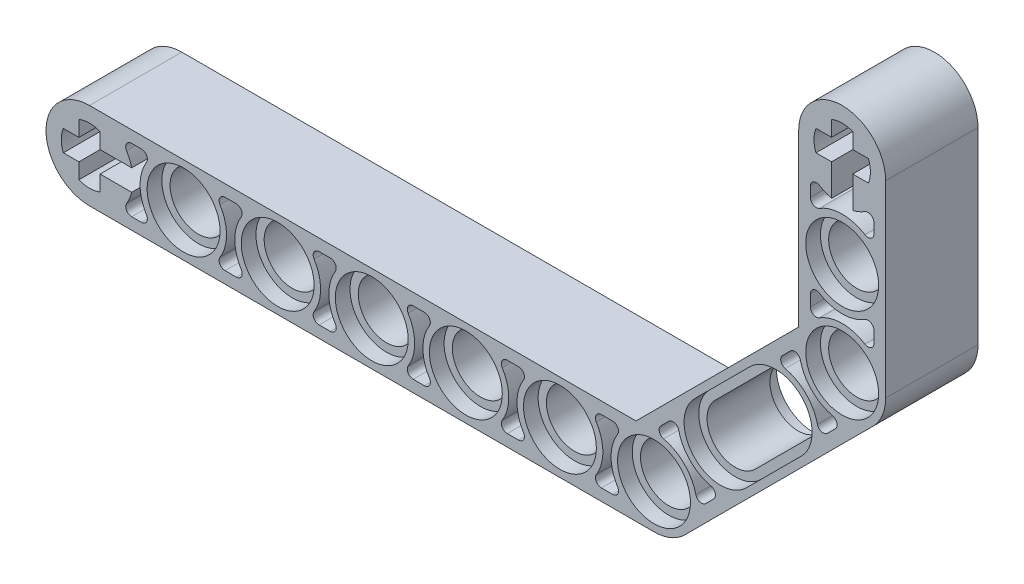
from build123d import *

# Parameters (mm, degrees)
SKETCH1_R            = 2.4
BEAM_DEPTH           = 3.925
AXLE_CUT_DEPTH       = 77.636711992
AXLE_CUT_DEPTH_BACK  = 77.636711992
SKETCH3_R            = 3.1
HOLE_SURROUND_DEPTH  = 1.25
CAVITY_CUT_DEPTH     = 3
FILLET2_R            = 0.5
FILLET2_OF_MIRROR2_R = 0.5
FILLET3_R            = 0.5


with BuildPart() as part:
    # Sketch1 → Beam (new, symmetric)
    with BuildSketch(Plane.XY):
        with BuildLine():
            Line((46.467409819, 3.7), (0, 3.7))
            ThreePointArc((0, 3.7), (-3.7, 0), (0, -3.7))
            Line((0, -3.7), (48, -3.7))
            ThreePointArc((48, -3.7), (49.4159287, -3.41835427), (50.61629509, -2.61629509))
            Line((50.61629509, -2.61629509), (66.61629509, 13.38370491))
            ThreePointArc((66.61629509, 13.38370491), (67.41835427, 14.5840713), (67.7, 16))
            Line((67.7, 16), (67.7, 32))
            ThreePointArc((67.7, 32), (64, 35.7), (60.3, 32))
            Line((60.3, 32), (60.3, 17.532590181))
            Line((60.3, 17.532590181), (46.467409819, 3.7))
        make_face()
        with Locations((8, 0)):
            Circle(SKETCH1_R, mode=Mode.SUBTRACT)
        with Locations((16, 0)):
            Circle(SKETCH1_R, mode=Mode.SUBTRACT)
        with Locations((24, 0)):
            Circle(SKETCH1_R, mode=Mode.SUBTRACT)
        with Locations((32, 0)):
            Circle(SKETCH1_R, mode=Mode.SUBTRACT)
        with Locations((40, 0)):
            Circle(SKETCH1_R, mode=Mode.SUBTRACT)
        with Locations((48, 0)):
            Circle(SKETCH1_R, mode=Mode.SUBTRACT)
        with BuildLine():
            ThreePointArc((56.646089476, 12.040202025), (60.040202025, 12.040202025), (60.040202025, 8.646089476))
            Line((60.040202025, 8.646089476), (55.353910524, 3.959797975))
            ThreePointArc((55.353910524, 3.959797975), (51.959797975, 3.959797975), (51.959797975, 7.353910524))
            Line((51.959797975, 7.353910524), (56.646089476, 12.040202025))
        make_face(mode=Mode.SUBTRACT)
        with Locations((64, 16)):
            Circle(SKETCH1_R, mode=Mode.SUBTRACT)
        with Locations((64, 24)):
            Circle(SKETCH1_R, mode=Mode.SUBTRACT)
    extrude(amount=BEAM_DEPTH, both=True)

    # Sketch2 → Axle Cut (cut, two sides: drawn at the far end of the back side and taken through both)
    with BuildSketch(Plane.XY.offset(-AXLE_CUT_DEPTH_BACK)):
        with BuildLine():
            ThreePointArc((-0.9, -2.224859546), (0, -2.4), (0.9, -2.224859546))
            Line((0.9, -2.224859546), (0.9, -0.9))
            Line((0.9, -0.9), (3.588871689, -0.9))
            ThreePointArc((3.588871689, -0.9), (3.188981578, -1.876271967), (2.529822128, -2.7))
            Line((2.529822128, -2.7), (5.470177872, -2.7))
            ThreePointArc((5.470177872, -2.7), (4.3, 0), (5.470177872, 2.7))
            Line((5.470177872, 2.7), (2.529822128, 2.7))
            ThreePointArc((2.529822128, 2.7), (3.188981578, 1.876271967), (3.588871689, 0.9))
            Line((3.588871689, 0.9), (0.9, 0.9))
            Line((0.9, 0.9), (0.9, 2.224859546))
            ThreePointArc((0.9, 2.224859546), (0, 2.4), (-0.9, 2.224859546))
            Line((-0.9, 2.224859546), (-0.9, 0.9))
            Line((-0.9, 0.9), (-2.224859546, 0.9))
            ThreePointArc((-2.224859546, 0.9), (-2.4, 0), (-2.224859546, -0.9))
            Line((-2.224859546, -0.9), (-0.9, -0.9))
            Line((-0.9, -0.9), (-0.9, -2.224859546))
        make_face()
        with BuildLine():
            Line((64.9, 28.411128311), (64.9, 31.1))
            Line((64.9, 31.1), (66.224859546, 31.1))
            ThreePointArc((66.224859546, 31.1), (66.4, 32), (66.224859546, 32.9))
            Line((66.224859546, 32.9), (64.9, 32.9))
            Line((64.9, 32.9), (64.9, 34.224859546))
            ThreePointArc((64.9, 34.224859546), (64, 34.4), (63.1, 34.224859546))
            Line((63.1, 34.224859546), (63.1, 32.9))
            Line((63.1, 32.9), (61.775140454, 32.9))
            ThreePointArc((61.775140454, 32.9), (61.6, 32), (61.775140454, 31.1))
            Line((61.775140454, 31.1), (63.1, 31.1))
            Line((63.1, 31.1), (63.1, 28.411128311))
            ThreePointArc((63.1, 28.411128311), (62.123728033, 28.811018422), (61.3, 29.470177872))
            Line((61.3, 29.470177872), (61.3, 26.529822128))
            ThreePointArc((61.3, 26.529822128), (64, 27.7), (66.7, 26.529822128))
            Line((66.7, 26.529822128), (66.7, 29.470177872))
            ThreePointArc((66.7, 29.470177872), (65.876271967, 28.811018422), (64.9, 28.411128311))
        make_face()
    extrude(amount=AXLE_CUT_DEPTH + AXLE_CUT_DEPTH_BACK, mode=Mode.SUBTRACT)

    # Sketch3 → Hole Surround (cut)
    with BuildSketch(Plane.XY.offset(3.925)):
        with Locations((64, 24)):
            Circle(SKETCH3_R)
        with Locations((64, 16)):
            Circle(SKETCH3_R)
        with Locations((48, 0)):
            Circle(SKETCH3_R)
        with Locations((40, 0)):
            Circle(SKETCH3_R)
        with Locations((32, 0)):
            Circle(SKETCH3_R)
        with Locations((24, 0)):
            Circle(SKETCH3_R)
        with Locations((16, 0)):
            Circle(SKETCH3_R)
        with Locations((8, 0)):
            Circle(SKETCH3_R)
        with BuildLine():
            Line((55.848885271, 3.464823228), (60.535176772, 8.151114729))
            ThreePointArc((60.535176772, 8.151114729), (60.535176772, 12.535176772), (56.151114729, 12.535176772))
            Line((56.151114729, 12.535176772), (51.464823228, 7.848885271))
            ThreePointArc((51.464823228, 7.848885271), (51.464823228, 3.464823228), (55.848885271, 3.464823228))
        make_face()
    hole_surround = extrude(amount=-HOLE_SURROUND_DEPTH, mode=Mode.SUBTRACT)

    # Sketch4 → Cavity Cut (cut)
    with BuildSketch(Plane.XY.offset(3.925)):
        with BuildLine():
            Line((60.354076248, 16.172452866), (58.170692885, 13.989069503))
            ThreePointArc((58.170692885, 13.989069503), (60.924085502, 12.924085502), (61.989069503, 10.170692885))
            Line((61.989069503, 10.170692885), (64.172452866, 12.354076248))
            ThreePointArc((64.172452866, 12.354076248), (61.419060249, 13.419060249), (60.354076248, 16.172452866))
        make_face()
        with BuildLine():
            ThreePointArc((53.829307115, 2.010930497), (51.075914498, 3.075914498), (50.010930497, 5.829307115))
            Line((50.010930497, 5.829307115), (47.827547134, 3.645923752))
            ThreePointArc((47.827547134, 3.645923752), (50.580939751, 2.580939751), (51.645923752, -0.172452866))
            Line((51.645923752, -0.172452866), (53.829307115, 2.010930497))
        make_face()
        with BuildLine():
            Line((61.3, 21.543885182), (61.3, 18.456114818))
            ThreePointArc((61.3, 18.456114818), (64, 19.65), (66.7, 18.456114818))
            Line((66.7, 18.456114818), (66.7, 21.543885182))
            ThreePointArc((66.7, 21.543885182), (64, 20.35), (61.3, 21.543885182))
        make_face()
        with BuildLine():
            ThreePointArc((45.543885182, -2.7), (44.35, 0), (45.543885182, 2.7))
            Line((45.543885182, 2.7), (42.456114818, 2.7))
            ThreePointArc((42.456114818, 2.7), (43.65, 0), (42.456114818, -2.7))
            Line((42.456114818, -2.7), (45.543885182, -2.7))
        make_face()
        with BuildLine():
            ThreePointArc((37.543885182, -2.7), (36.35, 0), (37.543885182, 2.7))
            Line((37.543885182, 2.7), (34.456114818, 2.7))
            ThreePointArc((34.456114818, 2.7), (35.65, 0), (34.456114818, -2.7))
            Line((34.456114818, -2.7), (37.543885182, -2.7))
        make_face()
        with BuildLine():
            ThreePointArc((29.543885182, -2.7), (28.35, 0), (29.543885182, 2.7))
            Line((29.543885182, 2.7), (26.456114818, 2.7))
            ThreePointArc((26.456114818, 2.7), (27.65, 0), (26.456114818, -2.7))
            Line((26.456114818, -2.7), (29.543885182, -2.7))
        make_face()
        with BuildLine():
            ThreePointArc((21.543885182, -2.7), (20.35, 0), (21.543885182, 2.7))
            Line((21.543885182, 2.7), (18.456114818, 2.7))
            ThreePointArc((18.456114818, 2.7), (19.65, 0), (18.456114818, -2.7))
            Line((18.456114818, -2.7), (21.543885182, -2.7))
        make_face()
        with BuildLine():
            ThreePointArc((13.543885182, -2.7), (12.35, 0), (13.543885182, 2.7))
            Line((13.543885182, 2.7), (10.456114818, 2.7))
            ThreePointArc((10.456114818, 2.7), (11.65, 0), (10.456114818, -2.7))
            Line((10.456114818, -2.7), (13.543885182, -2.7))
        make_face()
    cavity_cut = extrude(amount=-CAVITY_CUT_DEPTH, mode=Mode.SUBTRACT)

    # Fillet2
    fillet2_edges = [part.edges().sort_by_distance(p)[0] for p in [
        (61.3, 18.456114818, 2.425),
        (66.7, 18.456114818, 2.425),
        (66.7, 21.543885182, 2.425),
        (61.3, 21.543885182, 2.425),
        (58.170692885, 13.989069503, 2.425),
        (61.989069503, 10.170692885, 2.425),
        (64.172452866, 12.354076248, 2.425),
        (60.354076248, 16.172452866, 2.425),
        (50.010930497, 5.829307115, 2.425),
        (47.827547134, 3.645923752, 2.425),
        (51.645923752, -0.172452866, 2.425),
        (53.829307115, 2.010930497, 2.425),
        (45.543885182, 2.7, 2.425),
        (42.456114818, 2.7, 2.425),
        (42.456114818, -2.7, 2.425),
        (45.543885182, -2.7, 2.425),
        (37.543885182, 2.7, 2.425),
        (34.456114818, 2.7, 2.425),
        (34.456114818, -2.7, 2.425),
        (37.543885182, -2.7, 2.425),
        (29.543885182, 2.7, 2.425),
        (26.456114818, 2.7, 2.425),
        (26.456114818, -2.7, 2.425),
        (29.543885182, -2.7, 2.425),
        (21.543885182, 2.7, 2.425),
        (18.456114818, 2.7, 2.425),
        (18.456114818, -2.7, 2.425),
        (21.543885182, -2.7, 2.425),
        (13.543885182, -2.7, 2.425),
        (10.456114818, -2.7, 2.425),
        (13.543885182, 2.7, 2.425),
        (10.456114818, 2.7, 2.425),
    ]]
    fillet(fillet2_edges, radius=FILLET2_R)

    # Mirror2: Hole Surround, Cavity Cut across plane
    add(hole_surround.mirror(Plane.XY), mode=Mode.SUBTRACT)
    add(cavity_cut.mirror(Plane.XY), mode=Mode.SUBTRACT)

    # Fillet2 of Mirror2
    fillet2_of_mirror2_edges = [part.edges().sort_by_distance(p)[0] for p in [
        (61.3, 18.456114818, -2.425),
        (66.7, 18.456114818, -2.425),
        (66.7, 21.543885182, -2.425),
        (61.3, 21.543885182, -2.425),
        (58.170692885, 13.989069503, -2.425),
        (61.989069503, 10.170692885, -2.425),
        (64.172452866, 12.354076248, -2.425),
        (60.354076248, 16.172452866, -2.425),
        (50.010930497, 5.829307115, -2.425),
        (47.827547134, 3.645923752, -2.425),
        (51.645923752, -0.172452866, -2.425),
        (53.829307115, 2.010930497, -2.425),
        (45.543885182, 2.7, -2.425),
        (42.456114818, 2.7, -2.425),
        (42.456114818, -2.7, -2.425),
        (45.543885182, -2.7, -2.425),
        (37.543885182, 2.7, -2.425),
        (34.456114818, 2.7, -2.425),
        (34.456114818, -2.7, -2.425),
        (37.543885182, -2.7, -2.425),
        (29.543885182, 2.7, -2.425),
        (26.456114818, 2.7, -2.425),
        (26.456114818, -2.7, -2.425),
        (29.543885182, -2.7, -2.425),
        (21.543885182, 2.7, -2.425),
        (18.456114818, 2.7, -2.425),
        (18.456114818, -2.7, -2.425),
        (21.543885182, -2.7, -2.425),
        (13.543885182, -2.7, -2.425),
        (10.456114818, -2.7, -2.425),
        (13.543885182, 2.7, -2.425),
        (10.456114818, 2.7, -2.425),
    ]]
    fillet(fillet2_of_mirror2_edges, radius=FILLET2_OF_MIRROR2_R)

    # Fillet3
    fillet3_edges = [part.edges().sort_by_distance(p)[0] for p in [
        (66.7, 26.529822128, 0),
        (66.7, 29.470177872, 0),
        (61.3, 26.529822128, 0),
        (61.3, 29.470177872, 0),
        (2.529822128, -2.7, 0),
        (5.470177872, -2.7, 0),
        (5.470177872, 2.7, 0),
        (2.529822128, 2.7, 0),
    ]]
    fillet(fillet3_edges, radius=FILLET3_R)


solid = part.part
